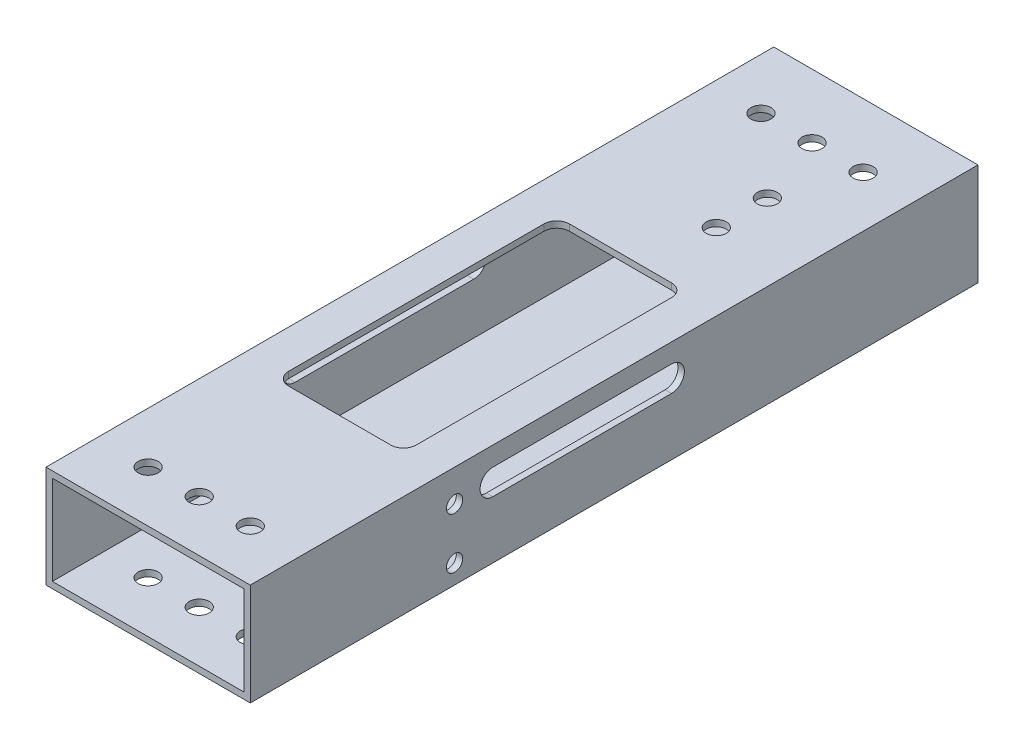
from build123d import *

# Parameters (mm, degrees)
SKETCH1_W               = 50.8
SKETCH1_H               = 25.4
SKETCH1_W_2             = 47.625
SKETCH1_H_2             = 22.225
BOSS_EXTRUDE1_DEPTH     = 180.975
SKETCH2_R               = 2.4892
CUT_EXTRUDE1_DEPTH      = 185.505475867
SKETCH9_W               = 31.75
SKETCH9_H               = 69.85
CUT_EXTRUDE2_DEPTH      = 23.8125
FILLET1_R               = 3.175
CUT_EXTRUDE3_DEPTH      = 184.189521057
CUT_EXTRUDE3_DEPTH_BACK = 184.189521057
SKETCH11_R              = 2.0193


with BuildPart() as part:
    # Sketch1 → Boss-Extrude1 (new body)
    with BuildSketch(Plane.XY):
        Rectangle(SKETCH1_W, SKETCH1_H)
        Rectangle(SKETCH1_W_2, SKETCH1_H_2, mode=Mode.SUBTRACT)
    extrude(amount=BOSS_EXTRUDE1_DEPTH)

    # Sketch2 → Cut-Extrude1 (cut, through all)
    with BuildSketch(Plane(origin=(0, 12.7, 0), x_dir=(1, 0, 0), z_dir=(0, 1, 0))):
        with Locations(Location((-12.7, -15.875, 0), (0, 0, 270))):
            Circle(SKETCH2_R)
        with Locations(Location((0, -15.875, 0), (0, 0, 270))):
            Circle(SKETCH2_R)
        with Locations(Location((12.7, -15.875, 0), (0, 0, 270))):
            Circle(SKETCH2_R)
        with Locations(Location((-12.7, -168.275, 0), (0, 0, 270))):
            Circle(SKETCH2_R)
        with Locations(Location((0, -168.275, 0), (0, 0, 270))):
            Circle(SKETCH2_R)
        with Locations(Location((12.7, -168.275, 0), (0, 0, 270))):
            Circle(SKETCH2_R)
        with Locations(Location((6.35, -33.3375, 0), (0, 0, 270))):
            Circle(SKETCH2_R)
        with Locations(Location((6.35, -46.0375, 0), (0, 0, 270))):
            Circle(SKETCH2_R)
    extrude(amount=-CUT_EXTRUDE1_DEPTH, mode=Mode.SUBTRACT)

    # Sketch9 → Cut-Extrude2 (cut)
    with BuildSketch(Plane(origin=(0, 12.7, 0), x_dir=(1, 0, 0), z_dir=(0, 1, 0))):
        with Locations((0, -98.425)):
            Rectangle(SKETCH9_W, SKETCH9_H)
    extrude(amount=-CUT_EXTRUDE2_DEPTH, mode=Mode.SUBTRACT)

    # Fillet1
    fillet1_edges = [part.edges().sort_by_distance(p)[0] for p in [
        (-15.875, 11.90625, 133.35),
        (-15.875, 11.90625, 63.5),
        (15.875, 11.90625, 63.5),
        (15.875, 11.90625, 133.35),
    ]]
    fillet(fillet1_edges, radius=FILLET1_R)

    # Sketch11 → Cut-Extrude3 (cut, two sides: drawn at the far end of the back side and taken through both)
    with BuildSketch(Plane(origin=(0, 0, 0), x_dir=(0, 0, -1), z_dir=(1, 0, 0)).offset(-CUT_EXTRUDE3_DEPTH_BACK)):
        with Locations((-130.175, 4.7625)):
            Circle(SKETCH11_R)
        with Locations((-130.175, -7.9375)):
            Circle(SKETCH11_R)
        with BuildLine():
            Line((-120.65, 7.9375), (-76.2, 7.9375))
            ThreePointArc((-76.2, 7.9375), (-73.025, 4.7625), (-76.2, 1.5875))
            Line((-76.2, 1.5875), (-120.65, 1.5875))
            ThreePointArc((-120.65, 1.5875), (-123.825, 4.7625), (-120.65, 7.9375))
        make_face()
    extrude(amount=CUT_EXTRUDE3_DEPTH + CUT_EXTRUDE3_DEPTH_BACK, mode=Mode.SUBTRACT)


solid = part.part
